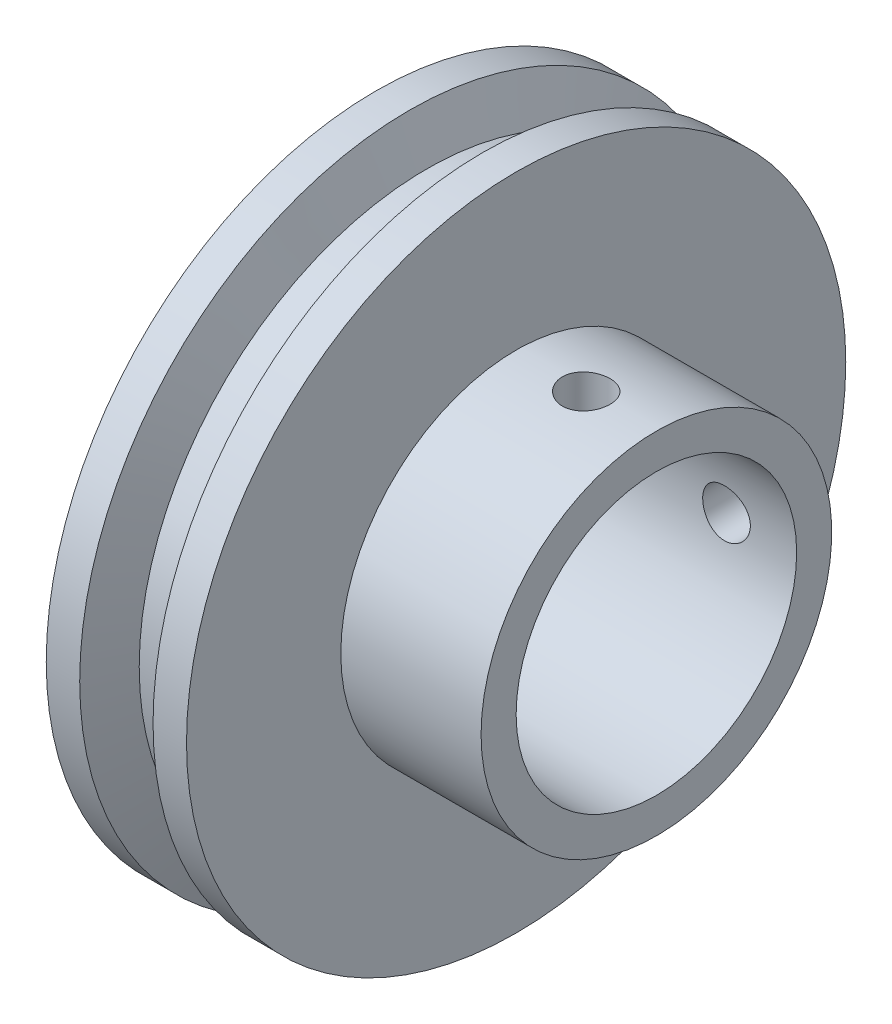
from build123d import *

# Parameters (mm, degrees)
SKETCH_7_W               = 1.7
SKETCH_7_H               = 23.5
PATTERN_CIRCULAR_2_COUNT = 2
PATTERN_CIRCULAR_2_ANGLE = 90


with BuildPart() as part:
    # 草图6 → 旋转2 (revolve)
    with BuildSketch(Plane.XY, mode=Mode.PRIVATE) as revolve_2_sk:
        Polygon((15, 12.5), (15, 10), (-5, 10), (-5, 23.5), (-2.614213562, 23.5), (-1.371572875, 20.5), (1.371572875, 20.5), (2.614213562, 23.5), (5, 23.5), (5, 12.5), align=None)
    revolve(revolve_2_sk.sketch.rotate(Axis((-5, 0, 0), (1, 0, 0)), 90), axis=Axis((-5, 0, 0), (1, 0, 0)))

    # 草图7 → 切除-旋转3 (revolve, cut)
    with BuildSketch(Plane.XY, mode=Mode.PRIVATE) as cut_revolve_3_sk:
        with Locations((10.85, 11.75)):
            Rectangle(SKETCH_7_W, SKETCH_7_H)
    cut_revolve_3 = revolve(cut_revolve_3_sk.sketch.rotate(Axis((10, 23.5, 0), (0, -1, 0)), 180), axis=Axis((10, 23.5, 0), (0, -1, 0)), mode=Mode.SUBTRACT)

    # 阵列(圆周)2: 切除-旋转3 ×2 about axis
    pattern_circular_2_axis = Axis((-5, 0, 0), (-1, 0, 0))
    for i in range(1, PATTERN_CIRCULAR_2_COUNT):
        add(cut_revolve_3.rotate(pattern_circular_2_axis, i * PATTERN_CIRCULAR_2_ANGLE / (PATTERN_CIRCULAR_2_COUNT - 1)), mode=Mode.SUBTRACT)


solid = part.part
